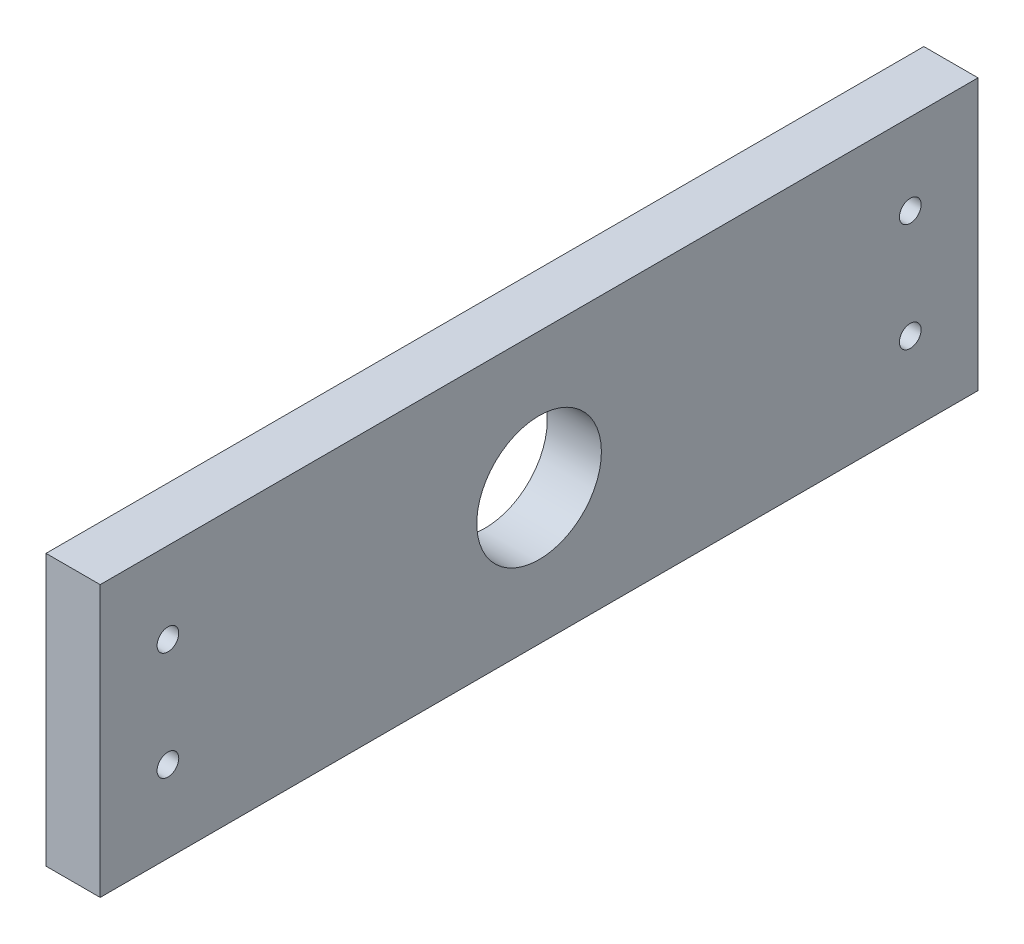
from build123d import *

# Parameters (mm, degrees)
SKETCH1_W           = 112
SKETCH1_H           = 50
SKETCH1_R           = 11.5
SKETCH1_W_2         = 25
SKETCH1_R_2         = 2
BOSS_EXTRUDE1_DEPTH = 10


with BuildPart() as part:
    # Sketch1 → Boss-Extrude1 (new body)
    # profile 1 of 3: a face of its own
    with BuildSketch(Plane(origin=(0, 0, 0), x_dir=(0, 0, -1), z_dir=(1, 0, 0))):
        Rectangle(SKETCH1_W, SKETCH1_H)
        Circle(SKETCH1_R, mode=Mode.SUBTRACT)
    # profile 2 of 3: a face of its own
    with BuildSketch(Plane(origin=(0, 0, 0), x_dir=(0, 0, -1), z_dir=(1, 0, 0))):
        with Locations((-68.5, 0)):
            Rectangle(SKETCH1_W_2, SKETCH1_H)
        with Locations((-68.5, -10)):
            Circle(SKETCH1_R_2, mode=Mode.SUBTRACT)
        with Locations((-68.5, 10)):
            Circle(SKETCH1_R_2, mode=Mode.SUBTRACT)
    # profile 3 of 3: a face of its own
    with BuildSketch(Plane(origin=(0, 0, 0), x_dir=(0, 0, -1), z_dir=(1, 0, 0))):
        with Locations((68.5, 0)):
            Rectangle(SKETCH1_W_2, SKETCH1_H)
        with Locations((68.5, -10)):
            Circle(SKETCH1_R_2, mode=Mode.SUBTRACT)
        with Locations((68.5, 10)):
            Circle(SKETCH1_R_2, mode=Mode.SUBTRACT)
    extrude(amount=BOSS_EXTRUDE1_DEPTH)


solid = part.part
